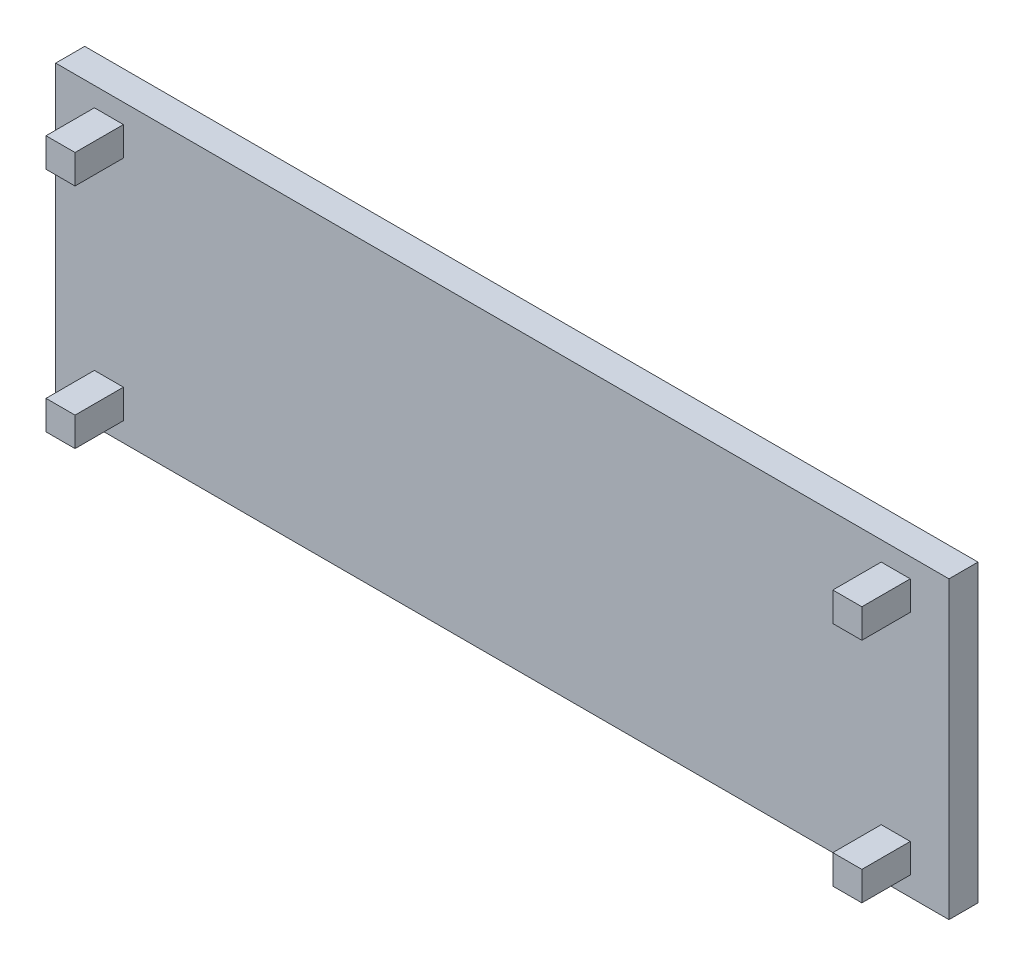
from build123d import *

# Parameters (mm, degrees)
SKETCH1_W           = 92.3
SKETCH1_H           = 30.5
SKETCH1_W_2         = 84.3
SKETCH1_H_2         = 26.5
BOSS_EXTRUDE1_DEPTH = 3
SKETCH2_W           = 3
SKETCH2_H           = 3
BOSS_EXTRUDE2_DEPTH = 5


with BuildPart() as part:
    # Sketch1 → Boss-Extrude1 (new body)
    # profile 1 of 2: a face of its own
    with BuildSketch(Plane.XY):
        with Locations((0, 0.6)):
            Rectangle(SKETCH1_W, SKETCH1_H)
        with Locations((0, 0.6)):
            Rectangle(SKETCH1_W_2, SKETCH1_H_2, mode=Mode.SUBTRACT)
    # profile 2 of 2: a face of its own
    with BuildSketch(Plane.XY):
        with Locations((0, 0.6)):
            Rectangle(SKETCH1_W_2, SKETCH1_H_2)
    extrude(amount=BOSS_EXTRUDE1_DEPTH)

    # Sketch2 → Boss-Extrude2 (add)
    with BuildSketch(Plane.XY.offset(3)):
        with Locations((-40.65, 12.35)):
            Rectangle(SKETCH2_W, SKETCH2_H)
        with Locations((40.65, 12.35)):
            Rectangle(SKETCH2_W, SKETCH2_H)
        with Locations((40.65, -11.15)):
            Rectangle(SKETCH2_W, SKETCH2_H)
        with Locations((-40.65, -11.15)):
            Rectangle(SKETCH2_W, SKETCH2_H)
    extrude(amount=BOSS_EXTRUDE2_DEPTH)


solid = part.part
